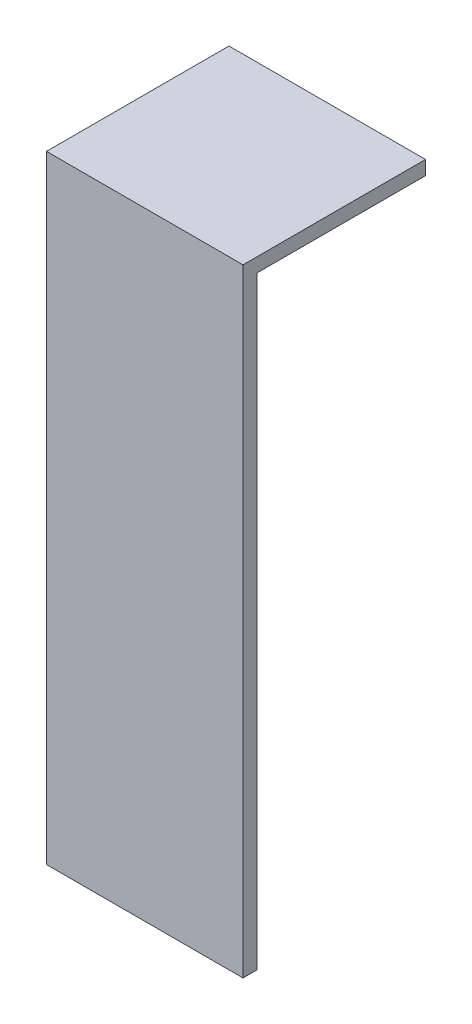
from build123d import *

# Parameters (mm, degrees)
SKETCH3_W           = 70
SKETCH3_H           = 220
BOSS_EXTRUDE2_DEPTH = 5
SKETCH4_W           = 5
SKETCH4_H           = 100
BOSS_EXTRUDE3_DEPTH = 10
SKETCH5_W           = 70
SKETCH5_H           = 5
BOSS_EXTRUDE4_DEPTH = 60


with BuildPart() as part:
    # Sketch3 → Boss-Extrude2 (new body)
    with BuildSketch(Plane.XY):
        with Locations((-67.431106164, 0)):
            Rectangle(SKETCH3_W, SKETCH3_H)
    extrude(amount=BOSS_EXTRUDE2_DEPTH)

    # Sketch4 → Boss-Extrude3 (add)
    with BuildSketch(Plane.XY):
        with Locations((-99.931106164, -60)):
            Rectangle(SKETCH4_W, SKETCH4_H)
    extrude(amount=-BOSS_EXTRUDE3_DEPTH)

    # Sketch5 → Boss-Extrude4 (add)
    with BuildSketch(Plane.XY):
        with Locations((-67.431106164, 107.5)):
            Rectangle(SKETCH5_W, SKETCH5_H)
    extrude(amount=-BOSS_EXTRUDE4_DEPTH)


solid = part.part
